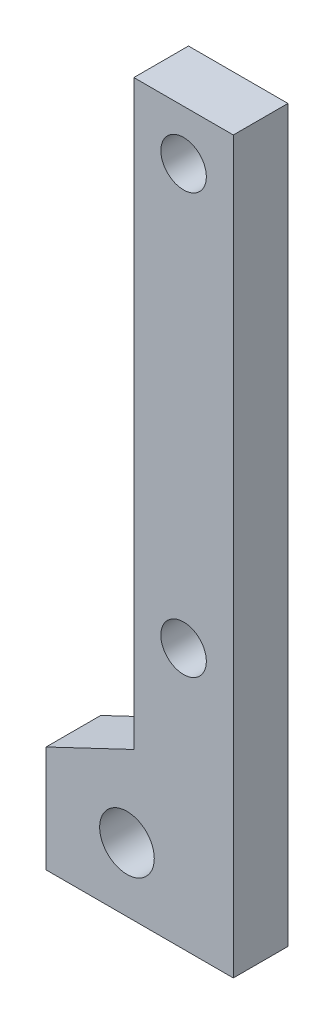
from build123d import *

# Parameters (mm, degrees)
SKETCH1_R           = 1.25
SKETCH1_R_2         = 1.5
BOSS_EXTRUDE1_DEPTH = 3


with BuildPart() as part:
    # Sketch1 → Boss-Extrude1 (new body)
    with BuildSketch(Plane.XY):
        Polygon((-31.401650429, 13.901650429), (-25.938490407, 13.901650429), (-25.938490407, -26.201638424), (-31.401650429, -26.201638424), (-36.223809579, -26.201638424), (-36.223809579, -20.354504277), (-31.401650429, -18.062129594), align=None)
        with Locations((-28.670070418, 11.170070418)):
            Circle(SKETCH1_R, mode=Mode.SUBTRACT)
        with Locations((-28.670070418, -11.879929582)):
            Circle(SKETCH1_R, mode=Mode.SUBTRACT)
        with Locations((-31.779993959, -22.69389364)):
            Circle(SKETCH1_R_2, mode=Mode.SUBTRACT)
    extrude(amount=BOSS_EXTRUDE1_DEPTH)


solid = part.part
